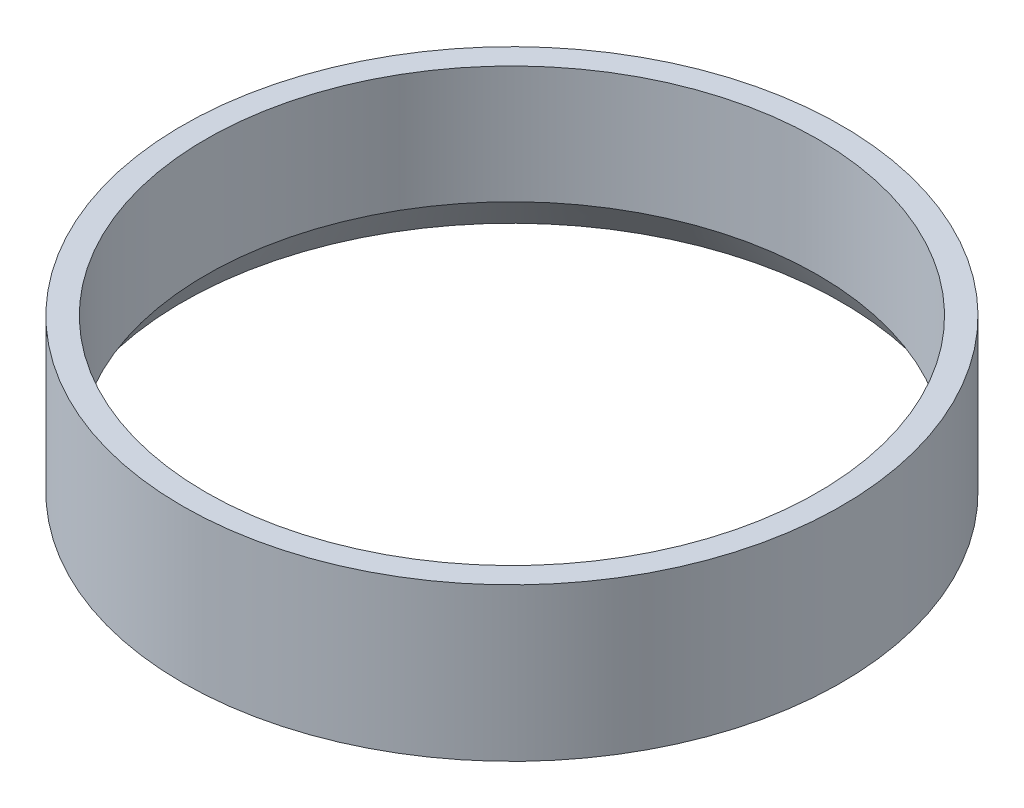
from build123d import *


with BuildPart() as part:
    # Эскиз1 → Повернуть1 (revolve)
    with BuildSketch(Plane.XY, mode=Mode.PRIVATE) as revolve_1_sk:
        Polygon((26.008320503, 0.005547002), (26, 0.005547002), (26, 10), (28.008320503, 10), (28.008320503, -2.994452998), align=None)
    revolve(revolve_1_sk.sketch.rotate(Axis((0, 10, 0), (0, -1, 0)), 90), axis=Axis((0, 10, 0), (0, -1, 0)))


solid = part.part
